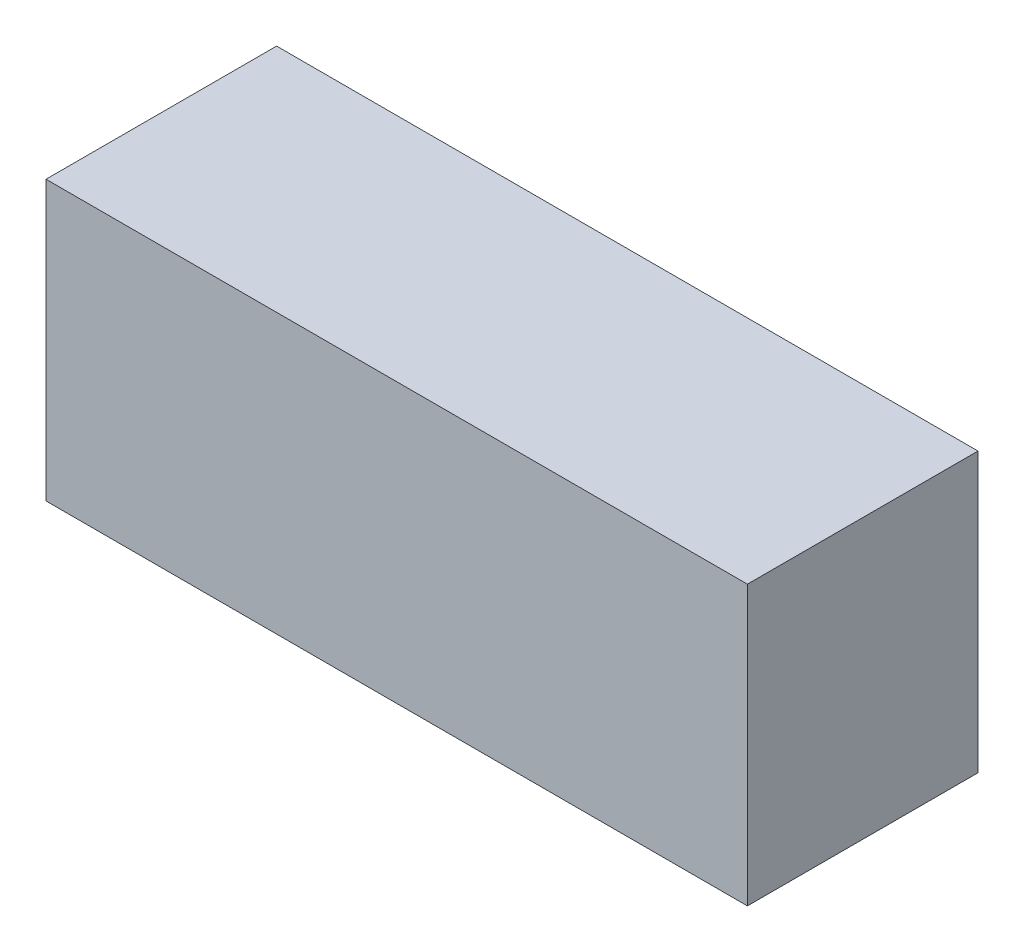
from build123d import *

# Parameters (mm, degrees)
SKETCH1_W           = 7.3
SKETCH1_H           = 2.4
BOSS_EXTRUDE1_DEPTH = 2.9


with BuildPart() as part:
    # Sketch1 → Boss-Extrude1 (new body)
    with BuildSketch(Plane(origin=(0, 0, 0), x_dir=(1, 0, 0), z_dir=(0, 1, 0))):
        Rectangle(SKETCH1_W, SKETCH1_H)
    extrude(amount=BOSS_EXTRUDE1_DEPTH)


solid = part.part
